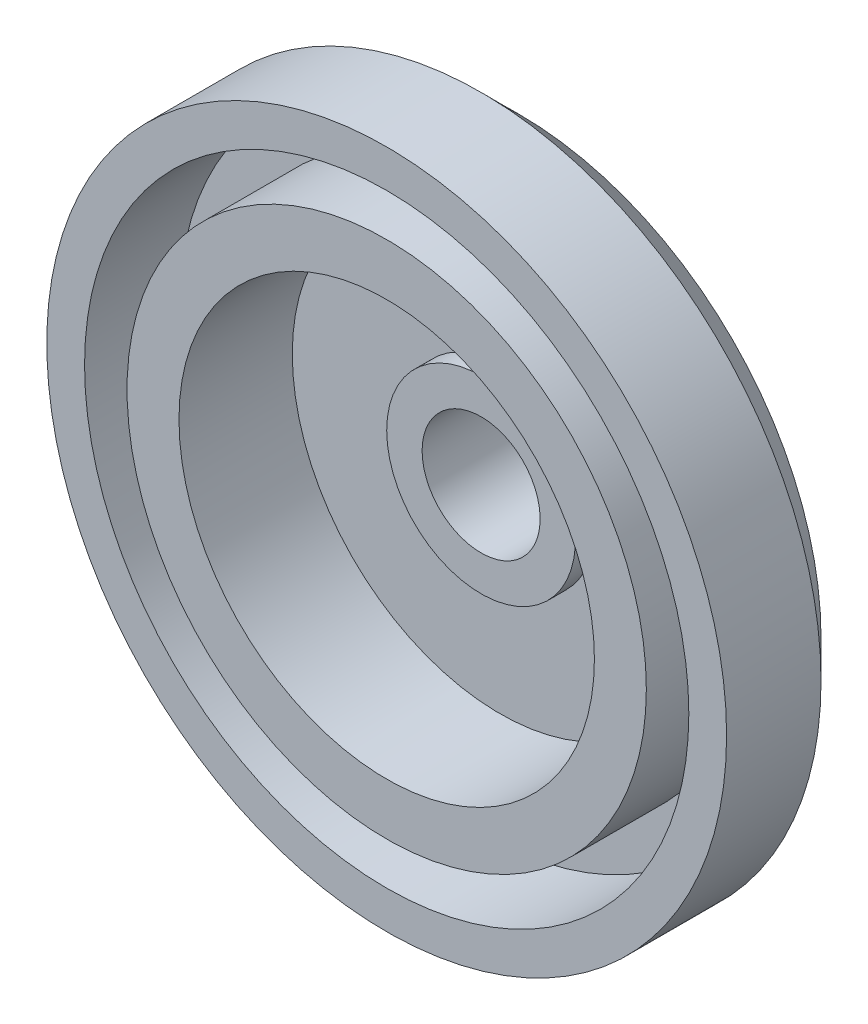
from build123d import *

# Parameters (mm, degrees)
ESQUISSE1_R             = 13.75
ESQUISSE1_R_2           = 11
BOSS_EXTRU_1_DEPTH      = 7
ESQUISSE1_R_3           = 18
ESQUISSE1_R_4           = 16
BOSS_EXTRU_1_2_DEPTH    = 7
ESQUISSE1_3_R           = 16
ESQUISSE1_3_R_2         = 13.75
BOSS_EXTRU_2_DEPTH      = 2
CHANFREIN1_SIZE         = 2
BOSS_EXTRU_3_DEPTH      = 4
BOSS_EXTRU_3_DEPTH_BACK = 2
ESQUISSE3_R             = 5
ESQUISSE3_R_2           = 3.125
ESQUISSE4_R             = 11
ESQUISSE4_R_2           = 3.834531167
BOSS_EXTRU_4_DEPTH      = 1


with BuildPart() as part:
    # Esquisse1 → Boss.-Extru.1 (new body)
    with BuildSketch(Plane.XY):
        Circle(ESQUISSE1_R)
        Circle(ESQUISSE1_R_2, mode=Mode.SUBTRACT)
    extrude(amount=BOSS_EXTRU_1_DEPTH)



with BuildPart() as body_2:
    # Esquisse1 → Boss.-Extru.1 2 (new body)
    with BuildSketch(Plane.XY):
        Circle(ESQUISSE1_R_3)
        Circle(ESQUISSE1_R_4, mode=Mode.SUBTRACT)
    extrude(amount=BOSS_EXTRU_1_2_DEPTH)


with BuildPart() as part_1:
    add(part.part)

    add(body_2.part)  # Boss.-Extru.2 merges body 2
    # Esquisse1<3> → Boss.-Extru.2 (add)
    with BuildSketch(Plane.XY):
        Circle(ESQUISSE1_3_R)
        Circle(ESQUISSE1_3_R_2, mode=Mode.SUBTRACT)
    extrude(amount=BOSS_EXTRU_2_DEPTH)

    # Chanfrein1
    chanfrein1_edges = [part_1.edges().sort_by_distance(p)[0] for p in [
        (-18, 0, 0),
    ]]
    chamfer(chanfrein1_edges, length=CHANFREIN1_SIZE)



with BuildPart() as body_2_2:
    # Esquisse3 → Boss.-Extru.3 (new, two sides: drawn at the far end of the back side and taken through both)
    with BuildSketch(Plane(origin=(0, 0, 0), x_dir=(-1, 0, 0), z_dir=(0, 0, -1)).offset(-BOSS_EXTRU_3_DEPTH_BACK)):
        Circle(ESQUISSE3_R)
        Circle(ESQUISSE3_R_2, mode=Mode.SUBTRACT)
    extrude(amount=BOSS_EXTRU_3_DEPTH + BOSS_EXTRU_3_DEPTH_BACK)


with BuildPart() as part_2:
    add(part_1.part)

    add(body_2_2.part)  # Boss.-Extru.4 merges body 2 2
    # Esquisse4 → Boss.-Extru.4 (add)
    with BuildSketch(Plane(origin=(0, 0, 0), x_dir=(-1, 0, 0), z_dir=(0, 0, -1))):
        Circle(ESQUISSE4_R)
        Circle(ESQUISSE4_R_2, mode=Mode.SUBTRACT)
    extrude(amount=-BOSS_EXTRU_4_DEPTH)


solid = part_2.part
